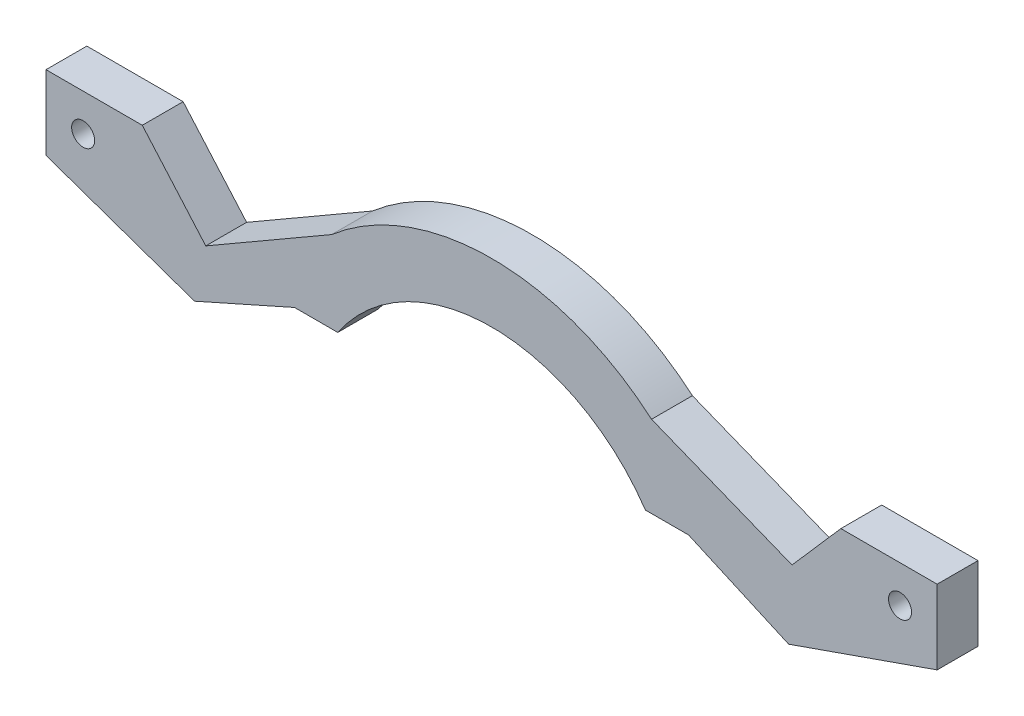
from build123d import *

# Parameters (mm, degrees)
EXTRUDE_1_DEPTH     = 5.5
SKETCH_2_R          = 1.55
CUT_EXTRUDE_1_DEPTH = 62.638056426


with BuildPart() as part:
    # ｽｹｯﾁ1 → ﾎﾞｽ - 押し出し1 (new body)
    with BuildSketch(Plane.XY):
        with BuildLine():
            Line((-60, 5), (-47.033321686, 5))
            Line((-47.033321686, 5), (-38.485827601, -4.794914235))
            Line((-38.485827601, -4.794914235), (-21.540659229, 5))
            ThreePointArc((-21.540659229, 5), (0, 13), (21.540659229, 5))
            Line((21.540659229, 5), (40.458326236, -2.534549412))
            Line((40.458326236, -2.534549412), (47.033321686, 5))
            Line((47.033321686, 5), (60, 5))
            Line((60, 5), (60, -5))
            Line((60, -5), (40, -12))
            Line((40, -12), (26.532998323, -6))
            Line((26.532998323, -6), (20.712315177, -6))
            ThreePointArc((20.712315177, -6), (0, 5), (-20.712315177, -6))
            Line((-20.712315177, -6), (-26.532998323, -6))
            Line((-26.532998323, -6), (-40, -12))
            Line((-40, -12), (-60, -5))
            Line((-60, -5), (-60, 5))
        make_face()
    extrude(amount=EXTRUDE_1_DEPTH)

    # ｽｹｯﾁ2 → ｶｯﾄ - 押し出し1 (cut, through all)
    with BuildSketch(Plane.XY.offset(5.5)):
        with Locations((-55, 0)):
            Circle(SKETCH_2_R)
        with Locations((55, 0)):
            Circle(SKETCH_2_R)
    extrude(amount=-CUT_EXTRUDE_1_DEPTH, mode=Mode.SUBTRACT)


solid = part.part
